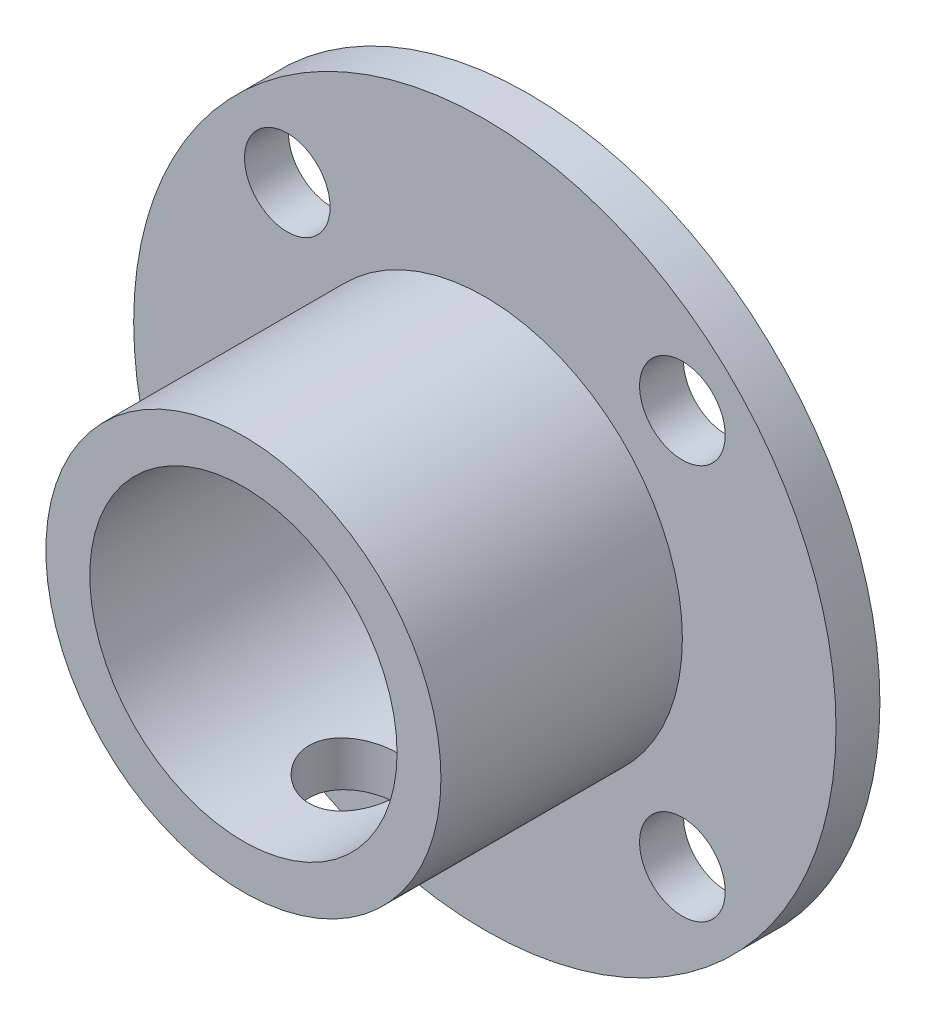
from build123d import *

# Parameters (mm, degrees)
SKETCH1_R           = 16
SKETCH1_R_2         = 1.95
SKETCH1_R_3         = 7
BOSS_EXTRUDE1_DEPTH = 2
SKETCH1_3_R         = 9
SKETCH1_3_R_2       = 7
BOSS_EXTRUDE2_DEPTH = 13
SKETCH2_R           = 2
CUT_EXTRUDE1_DEPTH  = 13


with BuildPart() as part:
    # Sketch1 → Boss-Extrude1 (new body)
    with BuildSketch(Plane(origin=(0, 0, 0), x_dir=(0, 1, 0), z_dir=(0, 0, 1))):
        Circle(SKETCH1_R)
        with Locations((-9, -9)):
            Circle(SKETCH1_R_2, mode=Mode.SUBTRACT)
        with Locations((9, -9)):
            Circle(SKETCH1_R_2, mode=Mode.SUBTRACT)
        with Locations((-9, 9)):
            Circle(SKETCH1_R_2, mode=Mode.SUBTRACT)
        with Locations((9, 9)):
            Circle(SKETCH1_R_2, mode=Mode.SUBTRACT)
        Circle(SKETCH1_R_3, mode=Mode.SUBTRACT)
    extrude(amount=BOSS_EXTRUDE1_DEPTH)

    # Sketch1<3> → Boss-Extrude2 (add)
    with BuildSketch(Plane(origin=(0, 0, 0), x_dir=(0, 1, 0), z_dir=(0, 0, 1))):
        Circle(SKETCH1_3_R)
        Circle(SKETCH1_3_R_2, mode=Mode.SUBTRACT)
    extrude(amount=BOSS_EXTRUDE2_DEPTH)

    # Sketch2 → Cut-Extrude1 (cut)
    with BuildSketch(Plane(origin=(0, 0, 0), x_dir=(-1, 0, 0), z_dir=(0, 1, 0))):
        with Locations((0, 8)):
            Circle(SKETCH2_R)
    extrude(amount=-CUT_EXTRUDE1_DEPTH, mode=Mode.SUBTRACT)


solid = part.part
